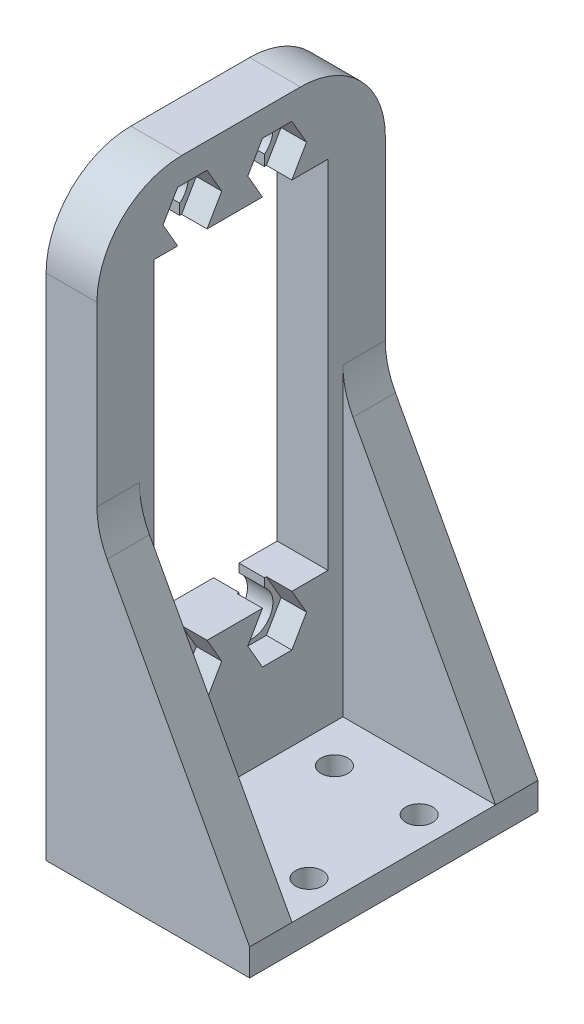
from build123d import *

# Parameters (mm, degrees)
SKETCH1_W                    = 34
SKETCH1_H                    = 70
SKETCH1_W_2                  = 20.5
SKETCH1_H_2                  = 42
BOSS_EXTRUDE1_DEPTH          = 3
CUT_EXTRUDE1_DEPTH           = 45.170833137
CUT_EXTRUDE2_START           = -3
CUT_EXTRUDE2_DEPTH           = 3
SKETCH4_W                    = 24
SKETCH4_H                    = 34
BOSS_EXTRUDE2_DEPTH          = 3.175
BOSS_EXTRUDE3_DEPTH          = 5
BOSS_EXTRUDE4_DEPTH          = 5
F_1_8_0_125_DIAMETER_HOLE1_D = 3.175
FILLET1_R                    = 10
FILLET2_R                    = 10


with BuildPart() as part:
    # Sketch1 → Boss-Extrude1 (new, symmetric)
    with BuildSketch(Plane(origin=(0, 0, 0), x_dir=(0, 0, -1), z_dir=(1, 0, 0))):
        with Locations((0.75, -5)):
            Rectangle(SKETCH1_W, SKETCH1_H)
        with Locations((0.75, 0)):
            Rectangle(SKETCH1_W_2, SKETCH1_H_2, mode=Mode.SUBTRACT)
    extrude(amount=BOSS_EXTRUDE1_DEPTH, both=True)

    # Sketch2 → Cut-Extrude1 (cut, through all)
    with BuildSketch(Plane.ZY.offset(3)):
        with BuildLine():
            Line((3.5, -21), (6.5, -21))
            Line((6.5, -21), (6.5, -22))
            ThreePointArc((6.5, -22), (5, -26.5), (3.5, -22))
            Line((3.5, -22), (3.5, -21))
        make_face()
        with BuildLine():
            Line((-6.5, -21), (-3.5, -21))
            Line((-3.5, -21), (-3.5, -22))
            ThreePointArc((-3.5, -22), (-5, -26.5), (-6.5, -22))
            Line((-6.5, -22), (-6.5, -21))
        make_face()
        with BuildLine():
            Line((6.5, 21), (6.5, 22.26))
            ThreePointArc((6.5, 22.26), (5, 26.76), (3.5, 22.26))
            Line((3.5, 22.26), (3.5, 21))
            Line((3.5, 21), (6.5, 21))
        make_face()
        with BuildLine():
            Line((-3.5, 21), (-3.5, 22.26))
            ThreePointArc((-3.5, 22.26), (-5, 26.76), (-6.5, 22.26))
            Line((-6.5, 22.26), (-6.5, 21))
            Line((-6.5, 21), (-3.5, 21))
        make_face()
    extrude(amount=-CUT_EXTRUDE1_DEPTH, mode=Mode.SUBTRACT)

    # Sketch3 → Cut-Extrude2 (cut)
    with BuildSketch(Plane(origin=(3, 0, 0), x_dir=(0, 0, -1), z_dir=(1, 0, 0)).offset(CUT_EXTRUDE2_START)):
        Polygon((-1.535898385, 24), (-3.267949192, 27), (-6.732050808, 27), (-8.464101615, 24), (-6.732050808, 21), (-3.267949192, 21), align=None)
        Polygon((3.267949192, 27), (1.535898385, 24), (3.267949192, 21), (6.732050808, 21), (8.464101615, 24), (6.732050808, 27), align=None)
        with BuildLine():
            Line((1.535898385, -24), (3.267949192, -27))
            Line((3.267949192, -27), (6.732050808, -27))
            Line((6.732050808, -27), (8.464101615, -24))
            Line((8.464101615, -24), (6.732050808, -21))
            Line((6.732050808, -21), (6.5, -21))
            Line((6.5, -21), (6.5, -22))
            ThreePointArc((6.5, -22), (5, -26.5), (3.5, -22))
            Line((3.5, -22), (3.5, -21))
            Line((3.5, -21), (3.267949192, -21))
            Line((3.267949192, -21), (1.535898385, -24))
        make_face()
        with BuildLine():
            Line((-1.535898385, -24), (-3.267949192, -21))
            Line((-3.267949192, -21), (-3.5, -21))
            Line((-3.5, -21), (-3.5, -22))
            ThreePointArc((-3.5, -22), (-5, -26.5), (-6.5, -22))
            Line((-6.5, -22), (-6.5, -21))
            Line((-6.5, -21), (-6.732050808, -21))
            Line((-6.732050808, -21), (-8.464101615, -24))
            Line((-8.464101615, -24), (-6.732050808, -27))
            Line((-6.732050808, -27), (-3.267949192, -27))
            Line((-3.267949192, -27), (-1.535898385, -24))
        make_face()
    extrude(amount=CUT_EXTRUDE2_DEPTH, mode=Mode.SUBTRACT)

    # Sketch4 → Boss-Extrude2 (add)
    with BuildSketch(Plane.XZ.offset(40)):
        with Locations((9, -0.75)):
            Rectangle(SKETCH4_W, SKETCH4_H)
    extrude(amount=-BOSS_EXTRUDE2_DEPTH)

    # Sketch5 → Boss-Extrude3 (add)
    with BuildSketch(Plane(origin=(0, 0, -17.75), x_dir=(-1, 0, 0), z_dir=(0, 0, -1))):
        Polygon((-3, -36.825), (-21, -36.825), (-3, -3.4125), align=None)
    extrude(amount=-BOSS_EXTRUDE3_DEPTH)

    # Sketch6 → Boss-Extrude4 (add)
    with BuildSketch(Plane.XY.offset(16.25)):
        Polygon((21, -36.825), (3, -36.825), (3, -3.4125), align=None)
    extrude(amount=-BOSS_EXTRUDE4_DEPTH)

    # 1/8 (0.125) Diameter Hole1 (through all)
    with Locations(Plane(origin=(0, -36.825, 0), x_dir=(1, 0, 0), z_dir=(0, 1, 0))):
        with Locations((7.5, 7.25), (17.5, 7.25), (17.5, -5.75), (7.5, -5.75)):
            Hole(F_1_8_0_125_DIAMETER_HOLE1_D / 2)

    # Fillet1
    fillet1_edges = [part.edges().sort_by_distance(p)[0] for p in [
        (0, 30, -17.75),
        (0, 30, 16.25),
    ]]
    fillet(fillet1_edges, radius=FILLET1_R)

    # Fillet2
    fillet2_edges = [part.edges().sort_by_distance(p)[0] for p in [
        (3, -3.4125, -15.25),
        (3, -3.4125, 13.75),
    ]]
    fillet(fillet2_edges, radius=FILLET2_R)


solid = part.part
